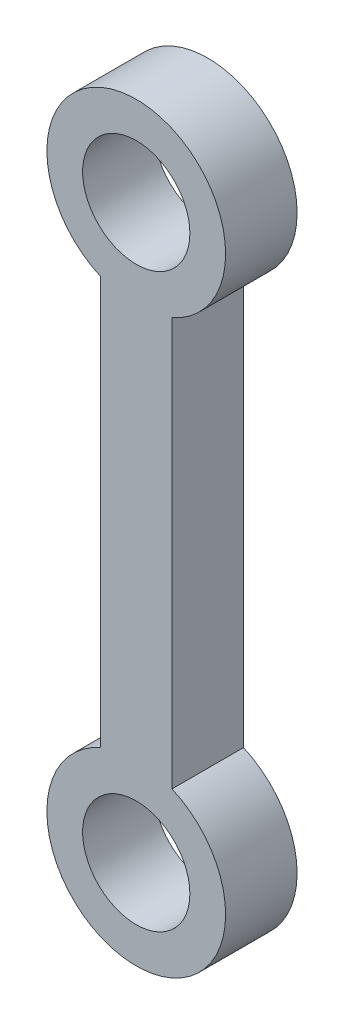
from build123d import *

# Parameters (mm, degrees)
SKETCH1_R           = 7.5
BOSS_EXTRUDE1_DEPTH = 10


with BuildPart() as part:
    # Sketch1 → Boss-Extrude1 (new body)
    with BuildSketch(Plane.XY):
        with BuildLine():
            ThreePointArc((-5, 11.456439237), (0, -12.5), (5, 11.456439237))
            Line((5, 11.456439237), (5, 68.543560763))
            ThreePointArc((5, 68.543560763), (0, 92.5), (-5, 68.543560763))
            Line((-5, 68.543560763), (-5, 11.456439237))
        make_face()
        with Locations((0, 80)):
            Circle(SKETCH1_R, mode=Mode.SUBTRACT)
        Circle(SKETCH1_R, mode=Mode.SUBTRACT)
    extrude(amount=BOSS_EXTRUDE1_DEPTH)


solid = part.part
